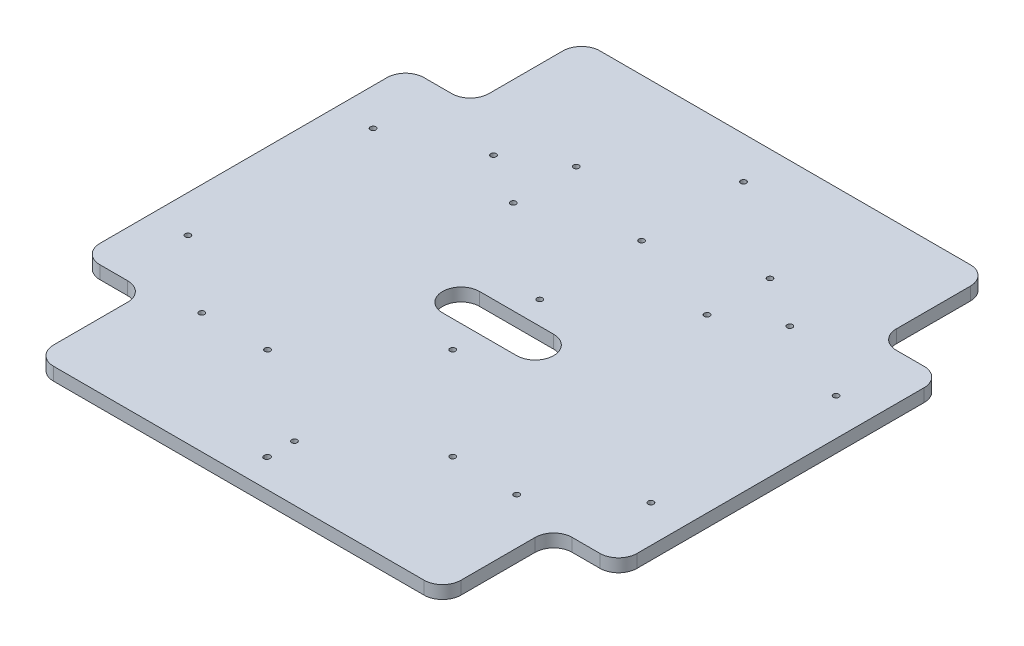
from build123d import *

# Parameters (mm, degrees)
SKETCH_1_W               = 300
SKETCH_1_H               = 300
EXTRUDE_1_DEPTH          = 7
SKETCH_2_W               = 240
SKETCH_2_H               = 2.5
CUT_EXTRUDE_1_DEPTH      = 50
SKETCH_3_W               = 60
SKETCH_3_H               = 2.5
CUT_EXTRUDE_2_DEPTH      = 50
CUT_EXTRUDE_3_DEPTH      = 50
CUT_EXTRUDE_4_DEPTH      = 50
CUT_EXTRUDE_5_DEPTH      = 50
SKETCH_7_W               = 35
SKETCH_7_H               = 60
CUT_EXTRUDE_6_DEPTH      = 50
SKETCH_8_R               = 1.5
CUT_EXTRUDE_7_DEPTH      = 500
FILLET_1_R               = 10
FILLET_2_R               = 10
FILLET_3_R               = 10
FILLET_4_R               = 10
FILLET_5_R               = 10
FILLET_6_R               = 10
SKETCH_9_R               = 1.5
CUT_EXTRUDE_8_DEPTH      = 50
PATTERN_CIRCULAR_1_COUNT = 10
SKETCH_11_R              = 3.300758287
SKETCH_11_R_2            = 5.737524446
SKETCH_11_R_3            = 4.850679924
SKETCH_11_R_4            = 5.043067488
EXTRUDE_3_DEPTH          = 7
CUT_EXTRUDE_9_DEPTH      = 50
SKETCH_14_R              = 1.5
CUT_EXTRUDE_10_DEPTH     = 50
SKETCH_15_R              = 1.5
CUT_EXTRUDE_11_DEPTH     = 50


with BuildPart() as part:
    # 草图1 → 凸台-拉伸1 (new body)
    with BuildSketch(Plane(origin=(0, 0, 0), x_dir=(1, 0, 0), z_dir=(0, 1, 0))):
        Rectangle(SKETCH_1_W, SKETCH_1_H)
    extrude(amount=EXTRUDE_1_DEPTH)

    # 草图2 → 切除-拉伸1 (cut)
    with BuildSketch(Plane(origin=(0, 7, 0), x_dir=(1, 0, 0), z_dir=(0, 1, 0))):
        with Locations((-30, -148.75)):
            Rectangle(SKETCH_2_W, SKETCH_2_H)
    extrude(amount=-CUT_EXTRUDE_1_DEPTH, mode=Mode.SUBTRACT)

    # 草图3 → 切除-拉伸2 (cut)
    with BuildSketch(Plane(origin=(0, 7, 0), x_dir=(1, 0, 0), z_dir=(0, 1, 0))):
        with Locations((120, -148.75)):
            Rectangle(SKETCH_3_W, SKETCH_3_H)
    extrude(amount=-CUT_EXTRUDE_2_DEPTH, mode=Mode.SUBTRACT)

    # 草图4 → 切除-拉伸3 (cut)
    with BuildSketch(Plane(origin=(0, 7, 0), x_dir=(1, 0, 0), z_dir=(0, 1, 0))):
        Polygon((-60.234749658, 147.5), (-150, 147.5), (-150, 150), (150, 150), (150, 148.75), (150, 147.5), align=None)
    extrude(amount=-CUT_EXTRUDE_3_DEPTH, mode=Mode.SUBTRACT)

    # 草图5 → 切除-拉伸4 (cut)
    with BuildSketch(Plane(origin=(0, 7, 0), x_dir=(1, 0, 0), z_dir=(0, 1, 0))):
        Polygon((-145, -36.273195626), (-145, -168.077464091), (-167.085104341, -168.077464091), (-167.085104341, 166.966608586), (-145, 166.966608586), align=None)
    extrude(amount=-CUT_EXTRUDE_4_DEPTH, mode=Mode.SUBTRACT)

    # 草图6 → 切除-拉伸5 (cut)
    with BuildSketch(Plane(origin=(0, 7, 0), x_dir=(1, 0, 0), z_dir=(0, 1, 0))):
        Polygon((150, -147.5), (150, 173.372620909), (145, 173.372620909), (145, -12.70619331), (145, -195.232190074), (157.067783109, -195.232190074), align=None)
    extrude(amount=-CUT_EXTRUDE_5_DEPTH, mode=Mode.SUBTRACT)

    # 草图7 → 切除-拉伸6 (cut)
    with BuildSketch(Plane.XZ):
        with Locations((-127.5, 117.5)):
            Rectangle(SKETCH_7_W, SKETCH_7_H)
        with Locations((-127.5, -117.5)):
            Rectangle(SKETCH_7_W, SKETCH_7_H)
        with Locations((127.5, 117.5)):
            Rectangle(SKETCH_7_W, SKETCH_7_H)
        with Locations((127.5, -117.5)):
            Rectangle(SKETCH_7_W, SKETCH_7_H)
    extrude(amount=-CUT_EXTRUDE_6_DEPTH, mode=Mode.SUBTRACT)

    # 草图8 → 切除-拉伸7 (cut)
    with BuildSketch(Plane(origin=(0, 7, 0), x_dir=(1, 0, 0), z_dir=(0, 1, 0))):
        with Locations(Location((-125, 50, 0), (0, 0, 270))):
            Circle(SKETCH_8_R)
        with Locations(Location((-125, -50, 0), (0, 0, 270))):
            Circle(SKETCH_8_R)
        with Locations(Location((125, -50, 0), (0, 0, 270))):
            Circle(SKETCH_8_R)
        with Locations(Location((125, 50, 0), (0, 0, 270))):
            Circle(SKETCH_8_R)
        with Locations(Location((-80, 70, 0), (0, 0, 270))):
            Circle(SKETCH_8_R)
        with Locations(Location((80, 70, 0), (0, 0, 270))):
            Circle(SKETCH_8_R)
        with Locations(Location((0, 70, 0), (0, 0, 270))):
            Circle(SKETCH_8_R)
        with Locations(Location((0, -132.5, 0), (0, 0, 270))):
            Circle(SKETCH_8_R)
        with Locations(Location((-85, -82.5, 0), (0, 0, 270))):
            Circle(SKETCH_8_R)
        with Locations(Location((85, -82.5, 0), (0, 0, 270))):
            Circle(SKETCH_8_R)
    extrude(amount=-CUT_EXTRUDE_7_DEPTH, mode=Mode.SUBTRACT)

    # 圆角1
    fillet_1_edges = [part.edges().sort_by_distance(p)[0] for p in [
        (110, 3.5, 147.5),
        (-110, 3.5, 147.5),
    ]]
    fillet(fillet_1_edges, radius=FILLET_1_R)

    # 圆角2
    fillet_2_edges = [part.edges().sort_by_distance(p)[0] for p in [
        (110, 3.5, 87.5),
        (-110, 3.5, 87.5),
    ]]
    fillet(fillet_2_edges, radius=FILLET_2_R)

    # 圆角3
    fillet_3_edges = [part.edges().sort_by_distance(p)[0] for p in [
        (145, 3.5, 87.5),
        (-145, 3.5, 87.5),
    ]]
    fillet(fillet_3_edges, radius=FILLET_3_R)

    # 圆角4
    fillet_4_edges = [part.edges().sort_by_distance(p)[0] for p in [
        (145, 3.5, -87.5),
        (-145, 3.5, -87.5),
    ]]
    fillet(fillet_4_edges, radius=FILLET_4_R)

    # 圆角5
    fillet_5_edges = [part.edges().sort_by_distance(p)[0] for p in [
        (-110, 3.5, -87.5),
        (110, 3.5, -87.5),
    ]]
    fillet(fillet_5_edges, radius=FILLET_5_R)

    # 圆角6
    fillet_6_edges = [part.edges().sort_by_distance(p)[0] for p in [
        (-110, 3.5, -147.5),
        (110, 3.5, -147.5),
    ]]
    fillet(fillet_6_edges, radius=FILLET_6_R)

    # 草图9 → 切除-拉伸8 (cut)
    with BuildSketch(Plane(origin=(0, 7, 0), x_dir=(1, 0, 0), z_dir=(0, 1, 0))):
        with Locations(Location((0, 125, 0), (0, 0, 270))):
            Circle(SKETCH_9_R)
    cut_extrude_8 = extrude(amount=-CUT_EXTRUDE_8_DEPTH, mode=Mode.SUBTRACT)

    # 阵列(圆周)1: 切除-拉伸8 ×10 about axis
    pattern_circular_1_axis = Axis((0, 0, -70), (0, 1, 0))
    for i in range(1, PATTERN_CIRCULAR_1_COUNT):
        add(cut_extrude_8.rotate(pattern_circular_1_axis, i * 360 / PATTERN_CIRCULAR_1_COUNT), mode=Mode.SUBTRACT)

    # 草图11 → 凸台-拉伸3 (add)
    with BuildSketch(Plane(origin=(0, 7, 0), x_dir=(1, 0, 0), z_dir=(0, 1, 0))):
        with Locations((-32.328188876, 114.495934691)):
            Circle(SKETCH_11_R)
        with Locations((32.328188876, 114.495934691)):
            Circle(SKETCH_11_R_2)
        with Locations((-32.328188876, 25.504065309)):
            Circle(SKETCH_11_R_3)
        with Locations((32.328188876, 25.504065309)):
            Circle(SKETCH_11_R_4)
    extrude(amount=-EXTRUDE_3_DEPTH)

    # 草图12 → 切除-拉伸9 (cut)
    with BuildSketch(Plane.XZ):
        with BuildLine():
            Line((-20, 17.5), (20, 17.5))
            ThreePointArc((20, 17.5), (30, 7.5), (20, -2.5))
            Line((20, -2.5), (-20, -2.5))
            ThreePointArc((-20, -2.5), (-30, 7.5), (-20, 17.5))
        make_face()
    extrude(amount=-CUT_EXTRUDE_9_DEPTH, mode=Mode.SUBTRACT)

    # 草图14 → 切除-拉伸10 (cut)
    with BuildSketch(Plane.XZ):
        with Locations((0, 132)):
            Circle(SKETCH_14_R)
        with Locations(Location((-50, 82, 0), (0, 0, 270))):
            Circle(SKETCH_14_R)
        with Locations(Location((50, 82, 0), (0, 0, 270))):
            Circle(SKETCH_14_R)
        with Locations(Location((0, 32, 0), (0, 0, 270))):
            Circle(SKETCH_14_R)
    extrude(amount=-CUT_EXTRUDE_10_DEPTH, mode=Mode.SUBTRACT)

    # 草图15 → 切除-拉伸11 (cut)
    with BuildSketch(Plane.XZ):
        with Locations(Location((0, 117.5, 0), (0, 0, 270))):
            Circle(SKETCH_15_R)
    extrude(amount=-CUT_EXTRUDE_11_DEPTH, mode=Mode.SUBTRACT)


solid = part.part
